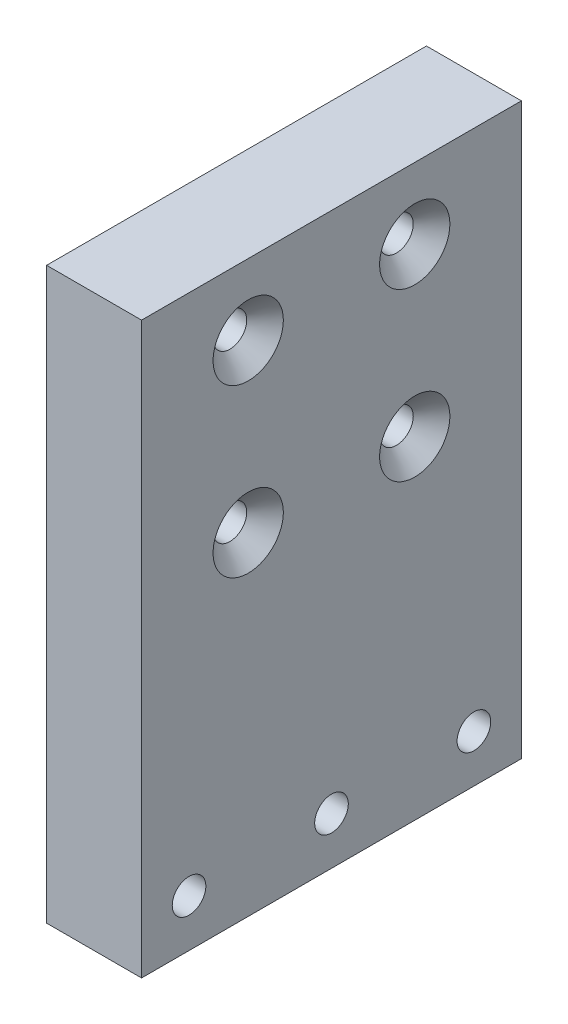
from build123d import *

# Parameters (mm, degrees)
SKETCH1_W                                           = 50.8
SKETCH1_H                                           = 76.2
BOSS_EXTRUDE1_DEPTH                                 = 12.7
CSK_FOR_M4_FLAT_HEAD_MACHINE_SCREW1_D               = 4.5
CSK_FOR_M4_FLAT_HEAD_MACHINE_SCREW1_CSINK_D         = 9.4
CSK_FOR_M4_FLAT_HEAD_MACHINE_SCREW1_CSINK_ANGLE     = 90
CBORE_FOR_8_BINDING_HEAD_MACHINE_SCREW1_D           = 4.4958
CBORE_FOR_8_BINDING_HEAD_MACHINE_SCREW1_CBORE_D     = 9.525
CBORE_FOR_8_BINDING_HEAD_MACHINE_SCREW1_CBORE_DEPTH = 2.667


with BuildPart() as part:
    # Sketch1 → Boss-Extrude1 (new body)
    with BuildSketch(Plane(origin=(0, 0, 0), x_dir=(0, 0, -1), z_dir=(1, 0, 0))):
        Rectangle(SKETCH1_W, SKETCH1_H)
    extrude(amount=BOSS_EXTRUDE1_DEPTH)

    # CSK for M4 Flat Head Machine Screw1 (through all)
    with Locations(Plane(origin=(12.7, 0, 0), x_dir=(0, 0, -1), z_dir=(1, 0, 0))):
        with Locations((11.136931804, 28.623863607), (-11.136931804, 28.623863607), (-11.136931804, 6.35), (11.136931804, 6.35)):
            CounterSinkHole(CSK_FOR_M4_FLAT_HEAD_MACHINE_SCREW1_D / 2, CSK_FOR_M4_FLAT_HEAD_MACHINE_SCREW1_CSINK_D / 2, counter_sink_angle=CSK_FOR_M4_FLAT_HEAD_MACHINE_SCREW1_CSINK_ANGLE)

    # CBORE for #8 Binding Head Machine Screw1 (through all)
    with Locations(Plane.ZY):
        with Locations((-19.05, -31.75), (0, -31.75), (19.05, -31.75)):
            CounterBoreHole(CBORE_FOR_8_BINDING_HEAD_MACHINE_SCREW1_D / 2, CBORE_FOR_8_BINDING_HEAD_MACHINE_SCREW1_CBORE_D / 2, CBORE_FOR_8_BINDING_HEAD_MACHINE_SCREW1_CBORE_DEPTH)


solid = part.part
